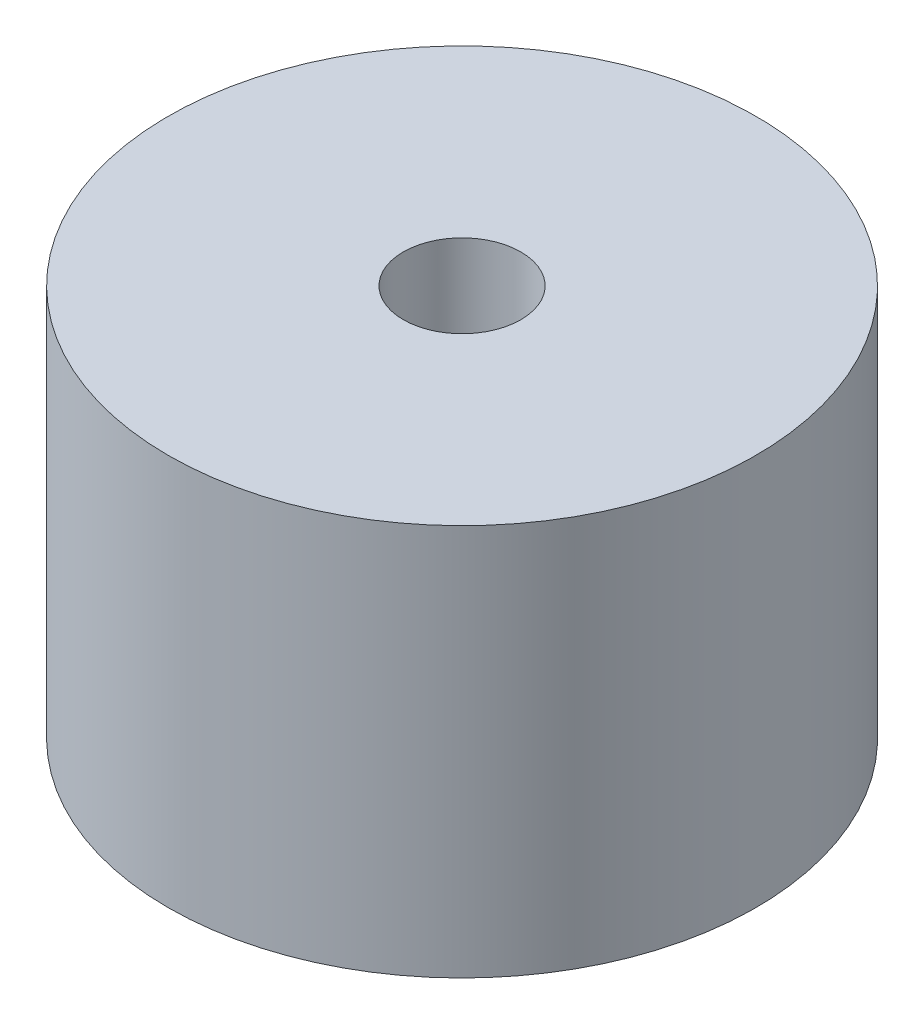
from build123d import *

# Parameters (mm, degrees)
ESQUISSE1_R             = 15
BOSS_EXTRU_1_DEPTH      = 20
ESQUISSE2_R             = 10
ENL_V_MAT_EXTRU_1_DEPTH = 12
ESQUISSE3_R             = 3
ENL_V_MAT_EXTRU_2_DEPTH = 12
ESQUISSE4_R             = 1.5
ENL_V_MAT_EXTRU_3_DEPTH = 8


with BuildPart() as part:
    # Esquisse1 → Boss.-Extru.1 (new body)
    with BuildSketch(Plane(origin=(0, 0, 0), x_dir=(1, 0, 0), z_dir=(0, 1, 0))):
        with Locations(Location((0, 0, 0), (0, 0, 270))):
            Circle(ESQUISSE1_R)
    extrude(amount=BOSS_EXTRU_1_DEPTH)

    # Esquisse2 → Enlèv. mat.-Extru.1 (cut)
    with BuildSketch(Plane(origin=(0, 0, 0), x_dir=(-1, 0, 0), z_dir=(0, -1, 0))):
        with Locations(Location((0, 0, 0), (0, 0, 90))):
            Circle(ESQUISSE2_R)
    extrude(amount=-ENL_V_MAT_EXTRU_1_DEPTH, mode=Mode.SUBTRACT)

    # Esquisse3 → Enlèv. mat.-Extru.2 (cut)
    with BuildSketch(Plane(origin=(0, 12, 0), x_dir=(-1, 0, 0), z_dir=(0, -1, 0))):
        with Locations(Location((0, 0, 0), (0, 0, 90))):
            Circle(ESQUISSE3_R)
    extrude(amount=-ENL_V_MAT_EXTRU_2_DEPTH, mode=Mode.SUBTRACT)

    # Esquisse4 → Enlèv. mat.-Extru.3 (cut)
    with BuildSketch(Plane(origin=(0, 0, 0), x_dir=(-1, 0, 0), z_dir=(0, -1, 0))):
        with Locations(Location((-12.7, 0, 0), (0, 0, 90))):
            Circle(ESQUISSE4_R)
        with Locations(Location((0, -12.7, 0), (0, 0, 90))):
            Circle(ESQUISSE4_R)
        with Locations(Location((12.7, 0, 0), (0, 0, 90))):
            Circle(ESQUISSE4_R)
        with Locations(Location((0, 12.7, 0), (0, 0, 90))):
            Circle(ESQUISSE4_R)
    extrude(amount=-ENL_V_MAT_EXTRU_3_DEPTH, mode=Mode.SUBTRACT)


solid = part.part
